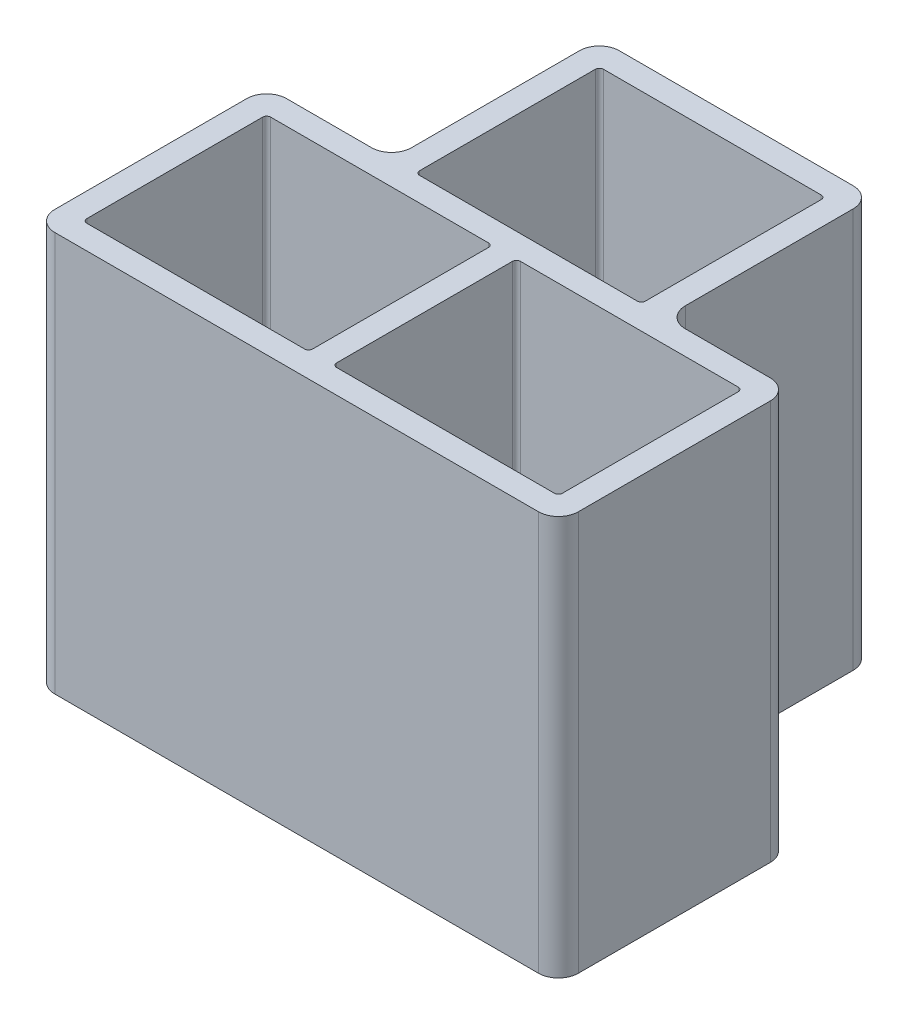
from build123d import *

# Parameters (mm, degrees)
SKETCH1_W               = 13.1
SKETCH1_H               = 5.8
BOSS_EXTRUDE1_DEPTH     = 5
SKETCH10_W              = 5.65
SKETCH10_H              = 4.6
CUT_EXTRUDE7_DEPTH      = 6.6
CUT_EXTRUDE6_DEPTH      = 9.735702605
CUT_EXTRUDE6_DEPTH_BACK = 9.735702605
SKETCH9_R               = 0.75
BOSS_EXTRUDE2_START     = -5
BOSS_EXTRUDE2_DEPTH     = 10
SKETCH12_W              = 5.65
SKETCH12_H              = 4.6
SKETCH12_R              = 0.75
BOSS_EXTRUDE3_DEPTH     = 3.4
FILETE1_R               = 0.5
FILETE2_R               = 0.1


with BuildPart() as part:
    # Sketch1 → Boss-Extrude1 (new, symmetric)
    with BuildSketch(Plane(origin=(0, 0, 0), x_dir=(1, 0, 0), z_dir=(0, 1, 0))):
        Rectangle(SKETCH1_W, SKETCH1_H)
    extrude(amount=BOSS_EXTRUDE1_DEPTH, both=True)

    # Sketch10 → Cut-Extrude7 (cut)
    with BuildSketch(Plane(origin=(0, 5, 0), x_dir=(1, 0, 0), z_dir=(0, 1, 0))):
        with Locations((-3.125, 0)):
            Rectangle(SKETCH10_W, SKETCH10_H)
        with Locations((3.125, 0)):
            Rectangle(SKETCH10_W, SKETCH10_H)
    extrude(amount=-CUT_EXTRUDE7_DEPTH, mode=Mode.SUBTRACT)

    # Sketch9 → Cut-Extrude6 (cut, two sides: drawn at the far end of the back side and taken through both)
    with BuildSketch(Plane(origin=(0, 0, 0), x_dir=(1, 0, 0), z_dir=(0, 1, 0)).offset(-CUT_EXTRUDE6_DEPTH_BACK)):
        with Locations(Location((-4.625, 0, 0), (0, 0, 270))):
            Circle(SKETCH9_R)
        with Locations(Location((-1.625, 0, 0), (0, 0, 270))):
            Circle(SKETCH9_R)
        with Locations(Location((1.625, 0, 0), (0, 0, 270))):
            Circle(SKETCH9_R)
        with Locations(Location((4.625, 0, 0), (0, 0, 270))):
            Circle(SKETCH9_R)
    extrude(amount=CUT_EXTRUDE6_DEPTH + CUT_EXTRUDE6_DEPTH_BACK, mode=Mode.SUBTRACT)

    # Sketch11 → Boss-Extrude2 (add)
    with BuildSketch(Plane(origin=(0, 0, 0), x_dir=(1, 0, 0), z_dir=(0, 1, 0)).offset(BOSS_EXTRUDE2_START)):
        Polygon((-3.425, 8.1), (-3.425, 2.9), (-2.825, 2.9), (-2.825, 7.5), (2.825, 7.5), (2.825, 2.9), (3.425, 2.9), (3.425, 8.1), align=None)
    extrude(amount=BOSS_EXTRUDE2_DEPTH)

    # Sketch12 → Boss-Extrude3 (add)
    with BuildSketch(Plane.XZ.offset(5)):
        with Locations((0, -5.2)):
            Rectangle(SKETCH12_W, SKETCH12_H)
        with Locations(Location((-1.5, -5.2, 0), (0, 0, 270))):
            Circle(SKETCH12_R, mode=Mode.SUBTRACT)
        with Locations(Location((1.5, -5.2, 0), (0, 0, 270))):
            Circle(SKETCH12_R, mode=Mode.SUBTRACT)
    extrude(amount=-BOSS_EXTRUDE3_DEPTH)

    # Filete1
    filete1_edges = [part.edges().sort_by_distance(p)[0] for p in [
        (-6.55, 0, -2.9),
        (-3.425, 0, -2.9),
        (-3.425, 0, -8.1),
        (3.425, 0, -8.1),
        (6.55, 0, -2.9),
        (3.425, 0, -2.9),
        (6.55, 0, 2.9),
        (-6.55, 0, 2.9),
    ]]
    fillet(filete1_edges, radius=FILETE1_R)

    # Filete2
    filete2_edges = [part.edges().sort_by_distance(p)[0] for p in [
        (-5.95, 1.7, 2.3),
        (-5.95, 1.7, -2.3),
        (-0.3, 1.7, -2.3),
        (-0.3, 1.7, 2.3),
        (5.95, 1.7, 2.3),
        (0.3, 1.7, 2.3),
        (0.3, 1.7, -2.3),
        (5.95, 1.7, -2.3),
        (2.825, 1.7, -7.5),
        (-2.825, 1.7, -7.5),
        (-2.825, 1.7, -2.9),
        (2.825, 1.7, -2.9),
    ]]
    fillet(filete2_edges, radius=FILETE2_R)


solid = part.part
